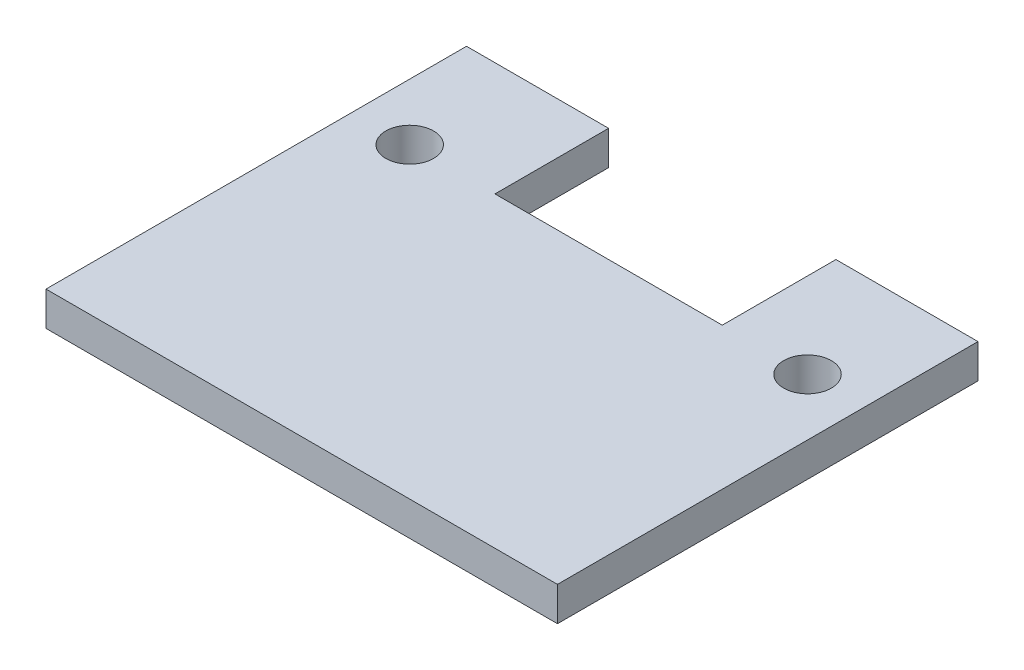
from build123d import *

# Parameters (mm, degrees)
SKIZZE2_R                       = 2.1
AUFSATZ_LINEAR_AUSTRAGEN1_DEPTH = 3


with BuildPart() as part:
    # Skizze2 → Aufsatz-Linear austragen1 (new body)
    with BuildSketch(Plane(origin=(0, 0, 0), x_dir=(1, 0, 0), z_dir=(0, 1, 0))):
        Polygon((-22.5, 18.5), (-22.5, -18.5), (22.5, -18.5), (22.5, 18.5), (10, 18.5), (10, 8.5), (-10, 8.5), (-10, 18.5), align=None)
        with Locations(Location((-17.5, 8.5, 0), (0, 0, 270))):
            Circle(SKIZZE2_R, mode=Mode.SUBTRACT)
        with Locations(Location((17.5, 8.5, 0), (0, 0, 270))):
            Circle(SKIZZE2_R, mode=Mode.SUBTRACT)
    extrude(amount=AUFSATZ_LINEAR_AUSTRAGEN1_DEPTH)


solid = part.part
